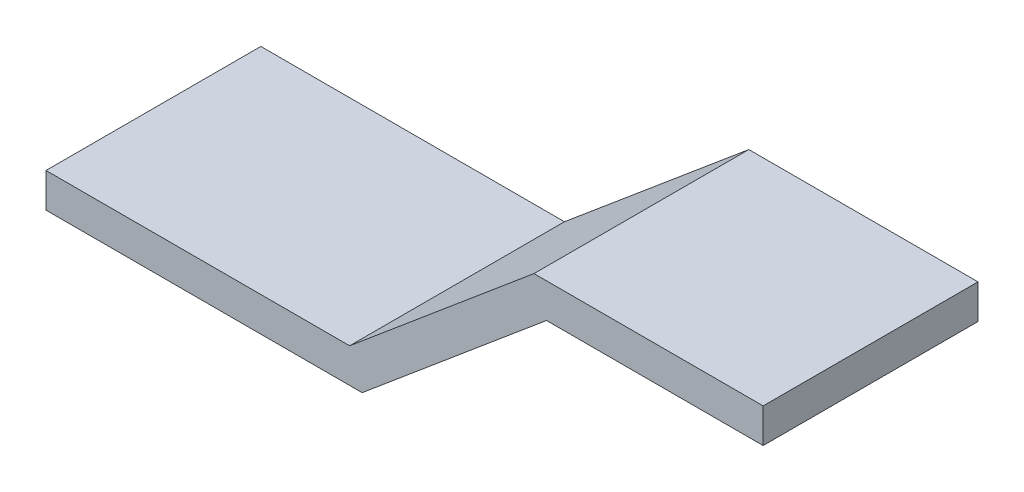
from build123d import *

# Parameters (mm, degrees)
SALIENTE_EXTRUIR1_DEPTH = 37.5


with BuildPart() as part:
    # Croquis1 → Saliente-Extruir1 (new, symmetric)
    with BuildSketch(Plane.XY):
        Polygon((186.553012944, 54), (106.553012944, 54), (42.198318944, 0), (-63.801681056, 0), (-63.801681056, -12), (46.565961755, -12), (110.920655755, 42), (186.553012944, 42), align=None)
    extrude(amount=SALIENTE_EXTRUIR1_DEPTH, both=True)


solid = part.part
